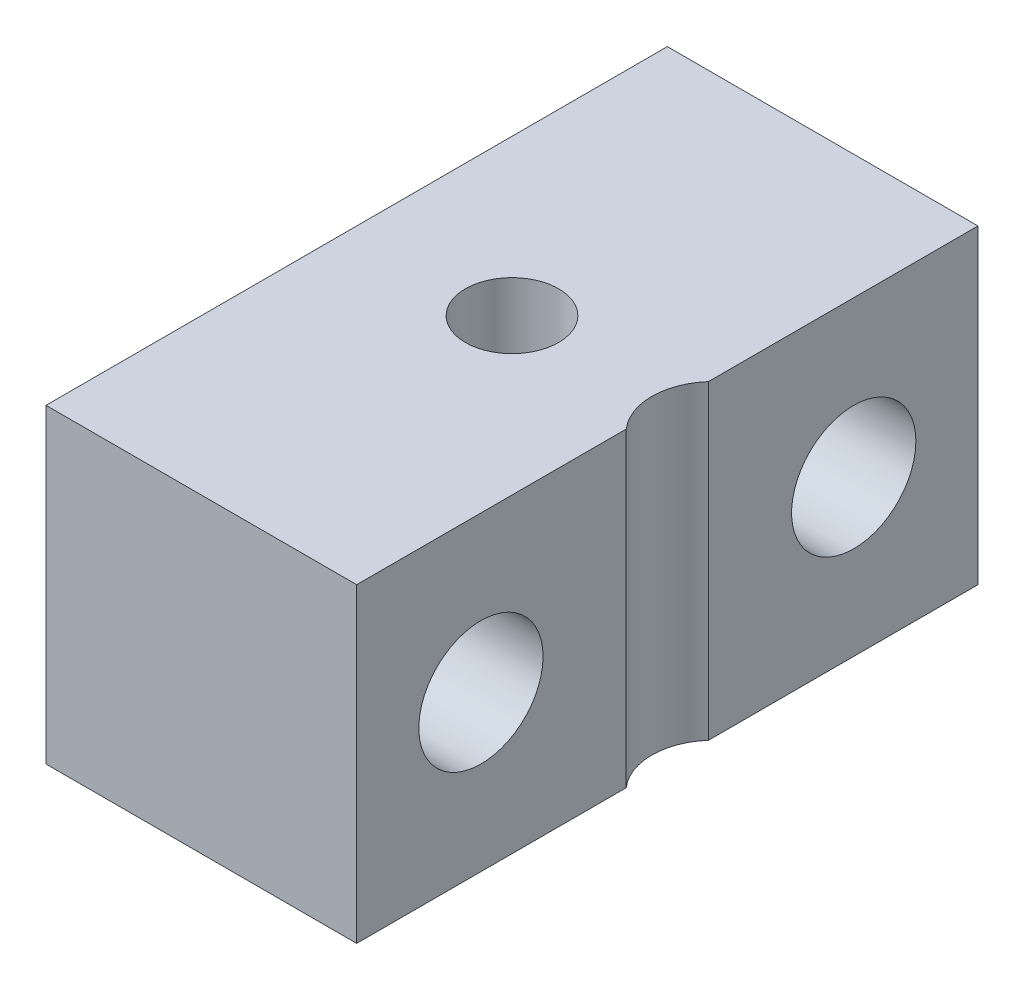
from build123d import *

# Parameters (mm, degrees)
BOSS_EXTRUDE1_DEPTH = 10
SKETCH2_R           = 2
CUT_EXTRUDE1_DEPTH  = 19
SKETCH3_R           = 1.5
CUT_EXTRUDE2_DEPTH  = 18


with BuildPart() as part:
    # Sketch1 → Boss-Extrude1 (new body)
    with BuildSketch(Plane(origin=(0, 0, 0), x_dir=(1, 0, 0), z_dir=(0, 1, 0))):
        with BuildLine():
            Line((0, 20), (0, 0))
            Line((0, 0), (10, 0))
            Line((10, 0), (10, 8.677124344))
            ThreePointArc((10, 8.677124344), (9.5, 10), (10, 11.322875656))
            Line((10, 11.322875656), (10, 20))
            Line((10, 20), (0, 20))
        make_face()
    extrude(amount=BOSS_EXTRUDE1_DEPTH)

    # Sketch2 → Cut-Extrude1 (cut)
    with BuildSketch(Plane(origin=(10, 0, 0), x_dir=(0, 0, -1), z_dir=(1, 0, 0))):
        with Locations((4, 5)):
            Circle(SKETCH2_R)
        with Locations((16, 5)):
            Circle(SKETCH2_R)
    extrude(amount=-CUT_EXTRUDE1_DEPTH, mode=Mode.SUBTRACT)

    # Sketch3 → Cut-Extrude2 (cut)
    with BuildSketch(Plane(origin=(0, 10, 0), x_dir=(1, 0, 0), z_dir=(0, 1, 0))):
        with Locations(Location((5, 10, 0), (0, 0, 270))):
            Circle(SKETCH3_R)
    extrude(amount=-CUT_EXTRUDE2_DEPTH, mode=Mode.SUBTRACT)


solid = part.part
